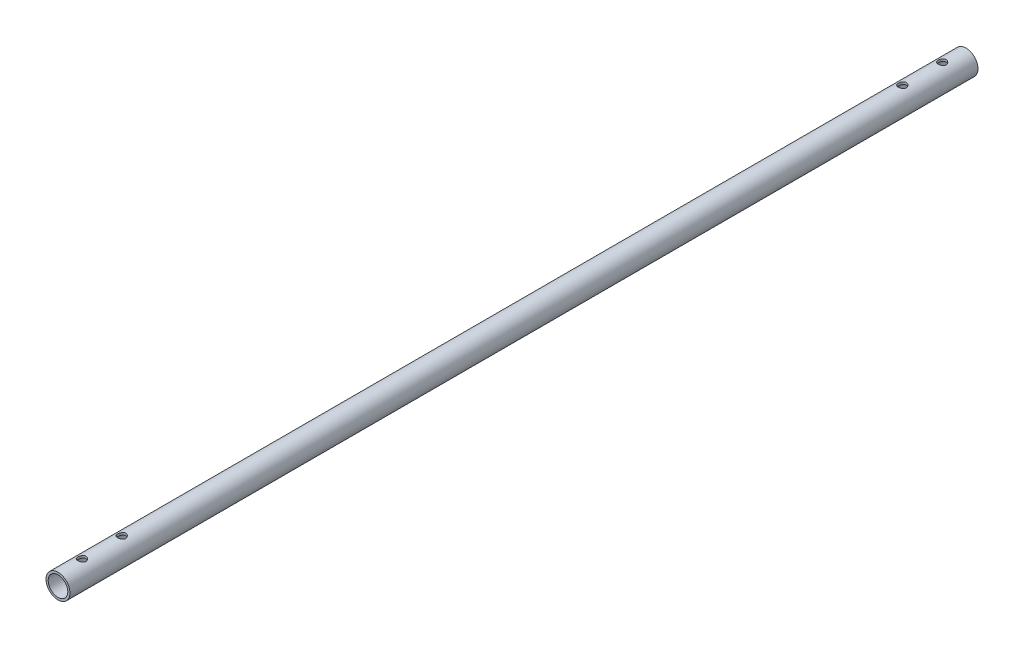
from build123d import *

# Parameters (mm, degrees)
SKETCH1_R           = 30.15
SKETCH1_R_2         = 24.61
EXTRUDE_THIN1_DEPTH = 1140
SKETCH2_R           = 10.05
CUT_EXTRUDE1_DEPTH  = 1141.797109481


with BuildPart() as part:
    # Sketch1 → Extrude-Thin1 (new, symmetric)
    with BuildSketch(Plane.XY):
        Circle(SKETCH1_R)
        Circle(SKETCH1_R_2, mode=Mode.SUBTRACT)
    extrude(amount=EXTRUDE_THIN1_DEPTH, both=True)

    # Sketch2 → Cut-Extrude1 (cut, symmetric)
    with BuildSketch(Plane(origin=(0, 0, 0), x_dir=(1, 0, 0), z_dir=(0, 1, 0))):
        with Locations(Location((0, 1080, 0), (0, 0, 270))):
            Circle(SKETCH2_R)
        with Locations(Location((0, 980, 0), (0, 0, 270))):
            Circle(SKETCH2_R)
    cut_extrude1 = extrude(amount=CUT_EXTRUDE1_DEPTH, both=True, mode=Mode.SUBTRACT)

    # Mirror1: Cut-Extrude1 across plane
    add(cut_extrude1.mirror(Plane.XY), mode=Mode.SUBTRACT)


solid = part.part
